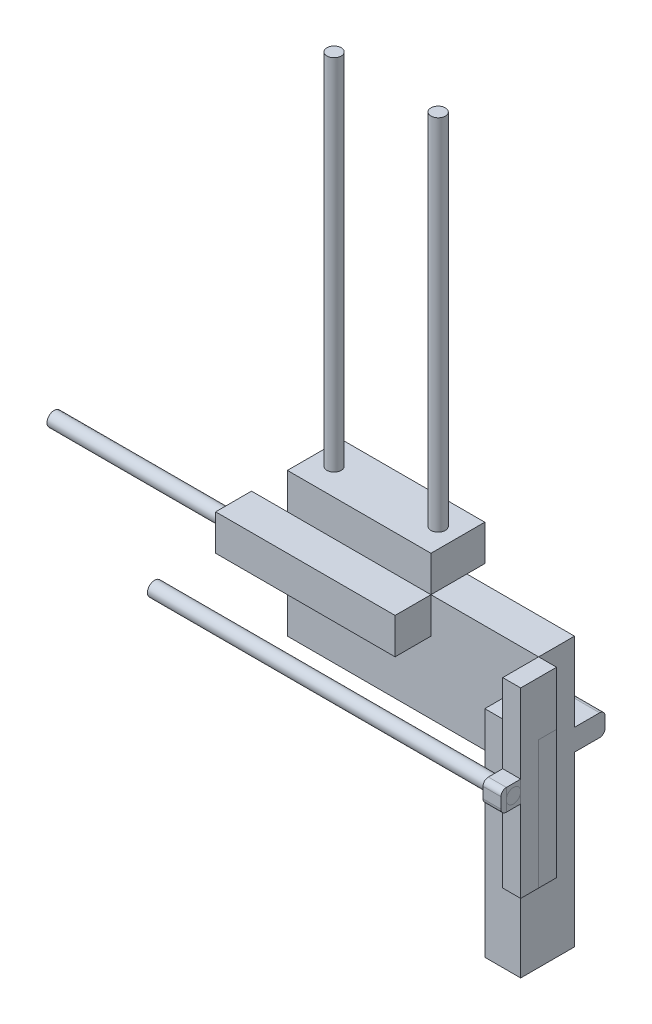
from build123d import *

# Parameters (mm, degrees)
SKETCH1_W              = 10
SKETCH1_H              = 15
BOSS_EXTRUDE1_DEPTH    = 60
SKETCH2_W              = 10
SKETCH2_H              = 15
BOSS_EXTRUDE2_DEPTH    = 60
SKETCH3_W              = 70
SKETCH3_H              = 10
BOSS_EXTRUDE3_DEPTH    = 15
SKETCH6_W              = 40
SKETCH6_H              = 15
BOSS_EXTRUDE4_DEPTH    = 10
SKETCH7_R              = 2
BOSS_EXTRUDE5_DEPTH    = 100
BOSS_EXTRUDE6_DEPTH    = 10
SKETCH10_W             = 5
SKETCH10_H             = 35.794380654
BOSS_EXTRUDE12_DEPTH   = 5
BOSS_EXTRUDE15_DEPTH   = 5
SKETCH19_R             = 2
BOSS_EXTRUDE18_DEPTH   = 150
BOSS_EXTRUDE19_DEPTH   = 10
SKETCH26_R             = 2
BOSS_EXTRUDE22_DEPTH   = 100
BOSS_EXTRUDE31_DEPTH   = 5
BOSS_EXTRUDE31_2_DEPTH = 5
BOSS_EXTRUDE33_DEPTH   = 5


with BuildPart() as part:
    # Sketch1 → Boss-Extrude1 (new body)
    with BuildSketch(Plane(origin=(0, 0, 0), x_dir=(1, 0, 0), z_dir=(0, 1, 0))):
        Rectangle(SKETCH1_W, SKETCH1_H)
    extrude(amount=BOSS_EXTRUDE1_DEPTH)

    # Sketch2 → Boss-Extrude2 (add)
    with BuildSketch(Plane(origin=(-5, 0, 0), x_dir=(0, 0, -1), z_dir=(1, 0, 0))):
        with Locations((2.5, 52.5)):
            Rectangle(SKETCH2_W, SKETCH2_H)
    extrude(amount=-BOSS_EXTRUDE2_DEPTH)

    # Sketch3 → Boss-Extrude3 (add)
    with BuildSketch(Plane(origin=(0, 60, 0), x_dir=(1, 0, 0), z_dir=(0, 1, 0))):
        with Locations((-30, 2.5)):
            Rectangle(SKETCH3_W, SKETCH3_H)
    extrude(amount=BOSS_EXTRUDE3_DEPTH)

    # Sketch6 → Boss-Extrude4 (add)
    with BuildSketch(Plane(origin=(0, 75, 0), x_dir=(1, 0, 0), z_dir=(0, 1, 0))):
        with Locations((-45, 5)):
            Rectangle(SKETCH6_W, SKETCH6_H)
    extrude(amount=BOSS_EXTRUDE4_DEPTH)

    # Sketch7 → Boss-Extrude5 (add)
    with BuildSketch(Plane(origin=(0, 85, 0), x_dir=(1, 0, 0), z_dir=(0, 1, 0))):
        with Locations(Location((-30.5, 5, 0), (0, 0, 90))):
            Circle(SKETCH7_R)
        with Locations(Location((-59.5, 5, 0), (0, 0, 270))):
            Circle(SKETCH7_R)
    extrude(amount=BOSS_EXTRUDE5_DEPTH)

    # Sketch8 → Boss-Extrude6 (add)
    with BuildSketch(Plane(origin=(5, 75, 2.5), x_dir=(-1, 0, 0), z_dir=(0, 0, -1))):
        Polygon((30, 0), (30, -10), (70, -10), (80, -10), (80, 0), align=None)
    extrude(amount=-BOSS_EXTRUDE6_DEPTH)

    # Sketch10 → Boss-Extrude12 (add)
    with BuildSketch(Plane(origin=(5, 0, 0), x_dir=(0, 0, -1), z_dir=(1, 0, 0))):
        with Locations((-5, 42.102809673)):
            Rectangle(SKETCH10_W, SKETCH10_H)
    extrude(amount=BOSS_EXTRUDE12_DEPTH)



with BuildPart() as body_2:
    # Sketch11 → Boss-Extrude15 (new body)
    with BuildSketch(Plane(origin=(5, 0, 0), x_dir=(0, 0, -1), z_dir=(1, 0, 0))):
        Polygon((-2.5, 60), (-2.5, 75), (-12.5, 75), (-12.5, 24.205619346), (-7.5, 24.205619346), (-7.5, 60), align=None)
    extrude(amount=BOSS_EXTRUDE15_DEPTH)


with BuildPart() as body_3:
    # Sketch19 → Boss-Extrude18 (new body)
    with BuildSketch(Plane(origin=(5, 0, 0), x_dir=(0, 0, -1), z_dir=(1, 0, 0))):
        with Locations((12.5, 50)):
            Circle(SKETCH19_R)
    extrude(amount=-BOSS_EXTRUDE18_DEPTH)


with BuildPart() as part_1:
    add(part.part)

    add(body_3.part)  # Boss-Extrude19 merges body 3
    # Sketch20 → Boss-Extrude19 (add)
    with BuildSketch(Plane(origin=(5, 0, 0), x_dir=(0, 0, -1), z_dir=(1, 0, 0))):
        with BuildLine():
            Line((12.5, 53.002424106), (7.5, 53.002424106))
            Line((7.5, 53.002424106), (7.5, 50))
            Line((7.5, 50), (7.5, 46.997575894))
            Line((7.5, 46.997575894), (12.5, 46.997575894))
            Line((12.5, 46.997575894), (14.5, 46.997575894))
            ThreePointArc((14.5, 46.997575894), (15.561517223, 47.437270724), (16.001212053, 48.498787947))
            Line((16.001212053, 48.498787947), (16.001212053, 51.501212053))
            ThreePointArc((16.001212053, 51.501212053), (15.561517223, 52.562729276), (14.5, 53.002424106))
            Line((14.5, 53.002424106), (12.5, 53.002424106))
        make_face()
    extrude(amount=-BOSS_EXTRUDE19_DEPTH)


with BuildPart() as body_3_2:
    # Sketch26 → Boss-Extrude22 (new body)
    with BuildSketch(Plane(origin=(10, 0, 0), x_dir=(0, 0, -1), z_dir=(1, 0, 0))):
        with Locations((-14.5, 50)):
            Circle(SKETCH26_R)
    extrude(amount=-BOSS_EXTRUDE22_DEPTH)


with BuildPart() as body_4:
    # Sketch33 → Boss-Extrude31 (new body)
    with BuildSketch(Plane(origin=(10, 0, 0), x_dir=(0, 0, -1), z_dir=(1, 0, 0))):
        with BuildLine():
            Line((-12.5, 50), (-12.5, 53))
            Line((-12.5, 53), (-16.5, 53))
            Line((-16.5, 53), (-16.5, 50))
            ThreePointArc((-16.5, 50), (-14.5, 52), (-12.5, 50))
        make_face()
    extrude(amount=-BOSS_EXTRUDE31_DEPTH)


with BuildPart() as body_5:
    # Sketch33 → Boss-Extrude31 2 (new body)
    with BuildSketch(Plane(origin=(10, 0, 0), x_dir=(0, 0, -1), z_dir=(1, 0, 0))):
        with BuildLine():
            Line((-12.5, 47), (-12.5, 50))
            ThreePointArc((-12.5, 50), (-14.5, 48), (-16.5, 50))
            Line((-16.5, 50), (-16.5, 47))
            Line((-16.5, 47), (-12.5, 47))
        make_face()
    extrude(amount=-BOSS_EXTRUDE31_2_DEPTH)


with BuildPart() as body_6:
    # Sketch36 → Boss-Extrude33 (new body)
    with BuildSketch(Plane(origin=(10, 0, 0), x_dir=(0, 0, -1), z_dir=(1, 0, 0))):
        with BuildLine():
            Line((-18, 48.5), (-18, 51.5))
            ThreePointArc((-18, 51.5), (-17.560660172, 52.560660172), (-16.5, 53))
            Line((-16.5, 53), (-16.5, 47))
            ThreePointArc((-16.5, 47), (-17.560660172, 47.439339828), (-18, 48.5))
        make_face()
    extrude(amount=-BOSS_EXTRUDE33_DEPTH)


solid = Compound([body_2.part, part_1.part, body_3_2.part, body_4.part, body_5.part, body_6.part])
